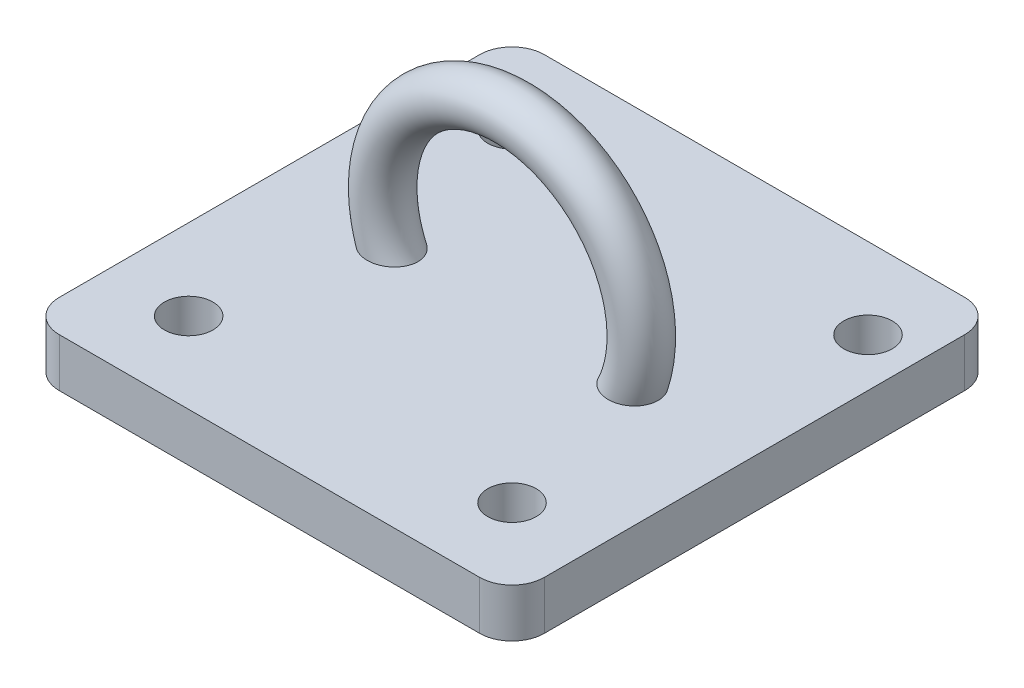
from build123d import *

# Parameters (mm, degrees)
SKETCH1_W           = 30
SKETCH1_H           = 30
BOSS_EXTRUDE1_DEPTH = 3
SWEEP1_PROFILE_R    = 1.5
SKETCH12_R          = 1.5
CUT_EXTRUDE1_DEPTH  = 3
FILLET1_R           = 2


with BuildPart() as part:
    # Sketch1 → Boss-Extrude1 (new body)
    with BuildSketch(Plane(origin=(0, 0, 0), x_dir=(1, 0, 0), z_dir=(0, 1, 0))):
        Rectangle(SKETCH1_W, SKETCH1_H)
    extrude(amount=BOSS_EXTRUDE1_DEPTH)

    # Sweep1: sweep along a path in Sketch2
    with BuildLine(Plane.XY) as sweep1_path:
        ThreePointArc((6.607920582, 1.389009429), (0, 13.898486736), (-6.607920582, 1.389009429))
    # Sweep1 profile (on start of the path) → Sweep1 (sweep)
    with BuildSketch(Plane(origin=(6.607920582, 1.389009429, 0), x_dir=(0.8259900728012373, -0.5636846632948309, 0), z_dir=(0.5636846632948309, 0.8259900728012373, 0))):
        Circle(SWEEP1_PROFILE_R)
    sweep(path=sweep1_path.line)

    # Sketch12 → Cut-Extrude1 (cut)
    with BuildSketch(Plane(origin=(0, 3, 0), x_dir=(1, 0, 0), z_dir=(0, 1, 0))):
        with Locations((-10, 10)):
            Circle(SKETCH12_R)
        with Locations((12.019460679, 10)):
            Circle(SKETCH12_R)
        with Locations((10, -10)):
            Circle(SKETCH12_R)
        with Locations((-10, -10)):
            Circle(SKETCH12_R)
    extrude(amount=-CUT_EXTRUDE1_DEPTH, mode=Mode.SUBTRACT)

    # Fillet1
    fillet1_edges = [part.edges().sort_by_distance(p)[0] for p in [
        (-15, 1.5, 15),
        (-15, 1.5, -15),
        (15, 1.5, 15),
        (15, 1.5, -15),
    ]]
    fillet(fillet1_edges, radius=FILLET1_R)


solid = part.part
